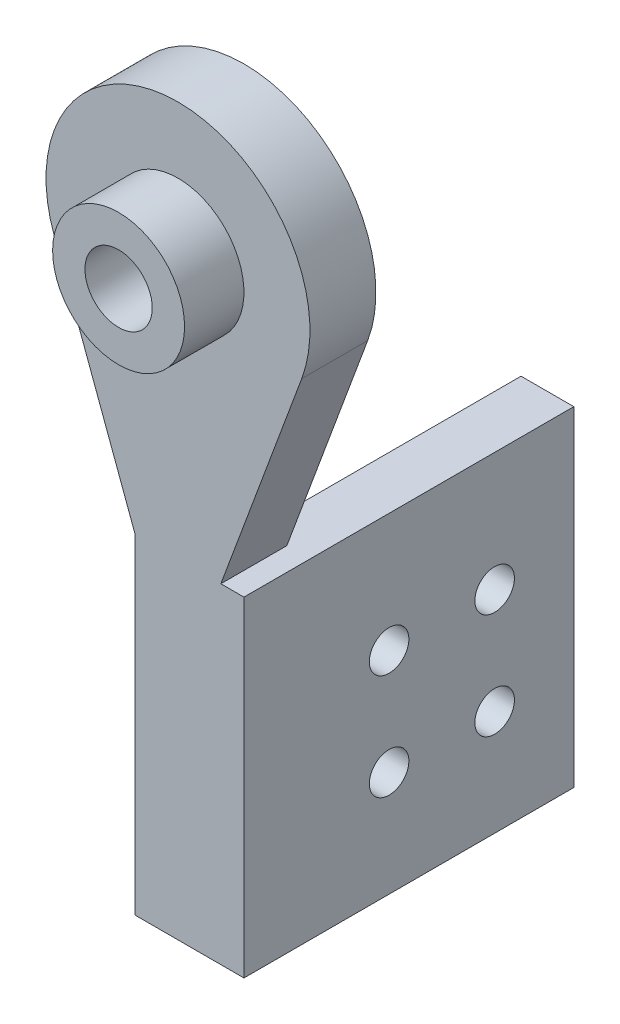
from build123d import *

# Parameters (mm, degrees)
SKETCH_1_R          = 1.25
EXTRUDE_1_DEPTH     = 5
SKETCH_2_W          = 5
SKETCH_2_H          = 25
EXTRUDE_2_DEPTH     = 4
SKETCH_3_W          = 4
SKETCH_3_H          = 25
EXTRUDE_3_DEPTH     = 20
SKETCH_4_R          = 1.5
CUT_EXTRUDE_1_DEPTH = 20
EXTRUDE_START       = -5
SKETCH_7_R          = 1.25
EXTRUDE_4_DEPTH     = 5
SKETCH_8_R          = 1.5
SKETCH_8_R_2        = 4
EXTRUDE_5_DEPTH     = 5
EXTRUDE_START_2     = 4
SKETCH_14_W         = 25
SKETCH_14_H         = 25
SKETCH_14_R         = 1.5
EXTRUDE_9_DEPTH     = 4
SKETCH_15_W         = 4
SKETCH_15_H         = 25
CUT_EXTRUDE_2_DEPTH = 100
SKETCH_16_R         = 10.000418411
SKETCH_16_R_2       = 2.55
EXTRUDE_10_DEPTH    = 5
EXTRUDE_START_3     = 4.5
SKETCH_18_R         = 5
SKETCH_18_R_2       = 2.55
EXTRUDE_11_DEPTH    = 4.5
SKETCH_19_W         = 25
SKETCH_19_H         = 25
SKETCH_19_R         = 1.5
EXTRUDE_12_DEPTH    = 4
SKETCH_20_W         = 25
SKETCH_20_H         = 25
CUT_EXTRUDE_3_DEPTH = 4
SKETCH_21_W         = 1.749900533
SKETCH_21_H         = 25
EXTRUDE_13_DEPTH    = 20
CUT_EXTRUDE_START   = -20
SKETCH_22_R         = 1.5
CUT_EXTRUDE_4_DEPTH = 20
SKETCH_23_W         = 25
SKETCH_23_H         = 25
CUT_EXTRUDE_5_DEPTH = 4
SKETCH_24_W         = 1.749900533
SKETCH_24_H         = 25
EXTRUDE_14_DEPTH    = 5


with BuildPart() as part:
    # 草图1 → 凸台-拉伸1 (new body)
    with BuildSketch(Plane.XY):
        Polygon((-3.581151343, -8.027992706), (-3.581151343, -12.611885422), (2.918848657, -12.611885422), (2.918848657, -6.641886627), (2.918848657, 12.388114578), (-3.581151343, 12.388114578), align=None)
        with Locations((-0.081151343, 8.237522913)):
            Circle(SKETCH_1_R, mode=Mode.SUBTRACT)
        with Locations((-0.081151343, 2.787522913)):
            Circle(SKETCH_1_R, mode=Mode.SUBTRACT)
        with Locations((-0.081151343, -2.662477087)):
            Circle(SKETCH_1_R, mode=Mode.SUBTRACT)
        with Locations((-0.000846901, -8.111885422)):
            Circle(SKETCH_1_R, mode=Mode.SUBTRACT)
    extrude(amount=EXTRUDE_1_DEPTH)

    # 草图2 → 凸台-拉伸2 (add)
    with BuildSketch(Plane.ZY.offset(3.581151343)):
        with Locations((2.5, -0.111885422)):
            Rectangle(SKETCH_2_W, SKETCH_2_H)
    extrude(amount=EXTRUDE_2_DEPTH)

    # 草图3 → 凸台-拉伸3 (add)
    with BuildSketch(Plane(origin=(0, 0, 0), x_dir=(-1, 0, 0), z_dir=(0, 0, -1))):
        with Locations((5.581151343, -0.111885422)):
            Rectangle(SKETCH_3_W, SKETCH_3_H)
    extrude(amount=EXTRUDE_3_DEPTH)

    # 草图4 → 切除-拉伸1 (cut)
    with BuildSketch(Plane(origin=(-3.581151343, 0, 0), x_dir=(0, 0, -1), z_dir=(1, 0, 0))):
        with Locations(Location((6, 3.388114578, 0), (0, 0, 90))):
            Circle(SKETCH_4_R)
        with Locations(Location((14, 3.388114578, 0), (0, 0, 180))):
            Circle(SKETCH_4_R)
        with Locations(Location((14, -4.611885422, 0), (0, 0, 90))):
            Circle(SKETCH_4_R)
        with Locations(Location((6, -4.611885422, 0), (0, 0, 180))):
            Circle(SKETCH_4_R)
    extrude(amount=-CUT_EXTRUDE_1_DEPTH, mode=Mode.SUBTRACT)

    # 草图7 → 凸台-拉伸4 (add)
    with BuildSketch(Plane.XY.offset(5).offset(EXTRUDE_START)):
        with Locations((-0.081151343, 8.237522913)):
            Circle(SKETCH_7_R)
        with Locations((-0.081151343, 2.787522913)):
            Circle(SKETCH_7_R)
        with Locations((-0.081151343, -2.662477087)):
            Circle(SKETCH_7_R)
        with Locations((-0.000846901, -8.111885422)):
            Circle(SKETCH_7_R)
    extrude(amount=EXTRUDE_4_DEPTH)

    # 草图8 → 凸台-拉伸5 (add)
    with BuildSketch(Plane.XY.offset(5)):
        with BuildLine():
            ThreePointArc((9.045368421, 28.911309576), (-0.331303735, 42.388418969), (-9.707833242, 28.911210329))
            Line((-9.707833242, 28.911210329), (-3.581151343, 12.388114578))
            Line((-3.581151343, 12.388114578), (2.918848657, 12.388114578))
            Line((2.918848657, 12.388114578), (9.045368421, 28.911309576))
        make_face()
        with Locations((-0.33125081, 25.388000558)):
            Circle(SKETCH_8_R, mode=Mode.SUBTRACT)
        with Locations((-7.33125081, 32.388000558)):
            Circle(SKETCH_8_R, mode=Mode.SUBTRACT)
        with Locations((-0.33125081, 32.388000558)):
            Circle(SKETCH_8_R_2, mode=Mode.SUBTRACT)
        with Locations((-0.33125081, 39.388000558)):
            Circle(SKETCH_8_R, mode=Mode.SUBTRACT)
        with Locations((6.668848657, 32.388114578)):
            Circle(SKETCH_8_R, mode=Mode.SUBTRACT)
    extrude(amount=-EXTRUDE_5_DEPTH)

    # 草图14 → 凸台-拉伸9 (add)
    with BuildSketch(Plane(origin=(2.918848657, 0, 0), x_dir=(0, 0, -1), z_dir=(1, 0, 0)).offset(EXTRUDE_START_2)):
        with Locations((7.5, -0.111885422)):
            Rectangle(SKETCH_14_W, SKETCH_14_H)
        with Locations(Location((6, 3.388114578, 0), (0, 0, 90))):
            Circle(SKETCH_14_R, mode=Mode.SUBTRACT)
        with Locations(Location((14, 3.388114578, 0), (0, 0, 180))):
            Circle(SKETCH_14_R, mode=Mode.SUBTRACT)
        with Locations(Location((14, -4.611885422, 0), (0, 0, 90))):
            Circle(SKETCH_14_R, mode=Mode.SUBTRACT)
        with Locations(Location((6, -4.611885422, 0), (0, 0, 180))):
            Circle(SKETCH_14_R, mode=Mode.SUBTRACT)
    extrude(amount=-EXTRUDE_9_DEPTH)

    # 草图15 → 切除-拉伸2 (cut)
    with BuildSketch(Plane(origin=(0, 0, -20), x_dir=(-1, 0, 0), z_dir=(0, 0, -1))):
        with Locations((5.581151343, -0.111885422)):
            Rectangle(SKETCH_15_W, SKETCH_15_H)
    extrude(amount=-CUT_EXTRUDE_2_DEPTH, mode=Mode.SUBTRACT)

    # 草图16 → 凸台-拉伸10 (add)
    with BuildSketch(Plane.XY.offset(5)):
        with Locations((-0.33125081, 32.388000558)):
            Circle(SKETCH_16_R)
        with Locations((-0.33125081, 32.388000558)):
            Circle(SKETCH_16_R_2, mode=Mode.SUBTRACT)
    extrude(amount=-EXTRUDE_10_DEPTH)

    # 草图18 → 凸台-拉伸11 (add)
    with BuildSketch(Plane.XY.offset(5).offset(EXTRUDE_START_3)):
        with Locations(Location((-0.33125081, 32.388000558, 0), (0, 0, 180))):
            Circle(SKETCH_18_R)
        with Locations((-0.33125081, 32.388000558)):
            Circle(SKETCH_18_R_2, mode=Mode.SUBTRACT)
    extrude(amount=-EXTRUDE_11_DEPTH)

    # 草图19 → 凸台-拉伸12 (add)
    with BuildSketch(Plane.ZY.offset(3.581151343)):
        with Locations((-7.5, -0.111885422)):
            Rectangle(SKETCH_19_W, SKETCH_19_H)
        with Locations(Location((-14, 3.388114578, 0), (0, 0, 90))):
            Circle(SKETCH_19_R, mode=Mode.SUBTRACT)
        with Locations(Location((-6, 3.388114578, 0), (0, 0, 90))):
            Circle(SKETCH_19_R, mode=Mode.SUBTRACT)
        with Locations(Location((-14, -4.611885422, 0), (0, 0, 90))):
            Circle(SKETCH_19_R, mode=Mode.SUBTRACT)
        with Locations(Location((-6, -4.611885422, 0), (0, 0, 90))):
            Circle(SKETCH_19_R, mode=Mode.SUBTRACT)
    extrude(amount=EXTRUDE_12_DEPTH)

    # 草图20 → 切除-拉伸3 (cut)
    with BuildSketch(Plane(origin=(6.918848657, 0, 0), x_dir=(0, 0, -1), z_dir=(1, 0, 0))):
        with Locations((7.5, -0.111885422)):
            Rectangle(SKETCH_20_W, SKETCH_20_H)
    extrude(amount=-CUT_EXTRUDE_3_DEPTH, mode=Mode.SUBTRACT)

    # 草图21 → 凸台-拉伸13 (add)
    with BuildSketch(Plane(origin=(0, 0, 0), x_dir=(-1, 0, 0), z_dir=(0, 0, -1))):
        Polygon((-0.66874919, -12.611885422), (-0.66874919, 5.526794347), (-0.66874919, 12.388114578), (-2.918848657, 12.388114578), (-2.918848657, -12.611885422), align=None)
        with Locations((-3.793798924, -0.111885422)):
            Rectangle(SKETCH_21_W, SKETCH_21_H)
    extrude(amount=EXTRUDE_13_DEPTH)

    # 草图22 → 切除-拉伸4 (cut)
    with BuildSketch(Plane.ZY.offset(7.581151343).offset(CUT_EXTRUDE_START)):
        with Locations((-14, 3.388114578)):
            Circle(SKETCH_22_R)
        with Locations((-6, 3.388114578)):
            Circle(SKETCH_22_R)
        with Locations((-14, -4.611885422)):
            Circle(SKETCH_22_R)
        with Locations((-6, -4.611885422)):
            Circle(SKETCH_22_R)
    extrude(amount=CUT_EXTRUDE_4_DEPTH, mode=Mode.SUBTRACT)

    # 草图23 → 切除-拉伸5 (cut)
    with BuildSketch(Plane.ZY.offset(7.581151343)):
        with Locations((-7.5, -0.111885422)):
            Rectangle(SKETCH_23_W, SKETCH_23_H)
    extrude(amount=-CUT_EXTRUDE_5_DEPTH, mode=Mode.SUBTRACT)

    # 草图24 → 凸台-拉伸14 (add)
    with BuildSketch(Plane.XY):
        with Locations((3.793798924, -0.111885422)):
            Rectangle(SKETCH_24_W, SKETCH_24_H)
    extrude(amount=EXTRUDE_14_DEPTH)


solid = part.part
